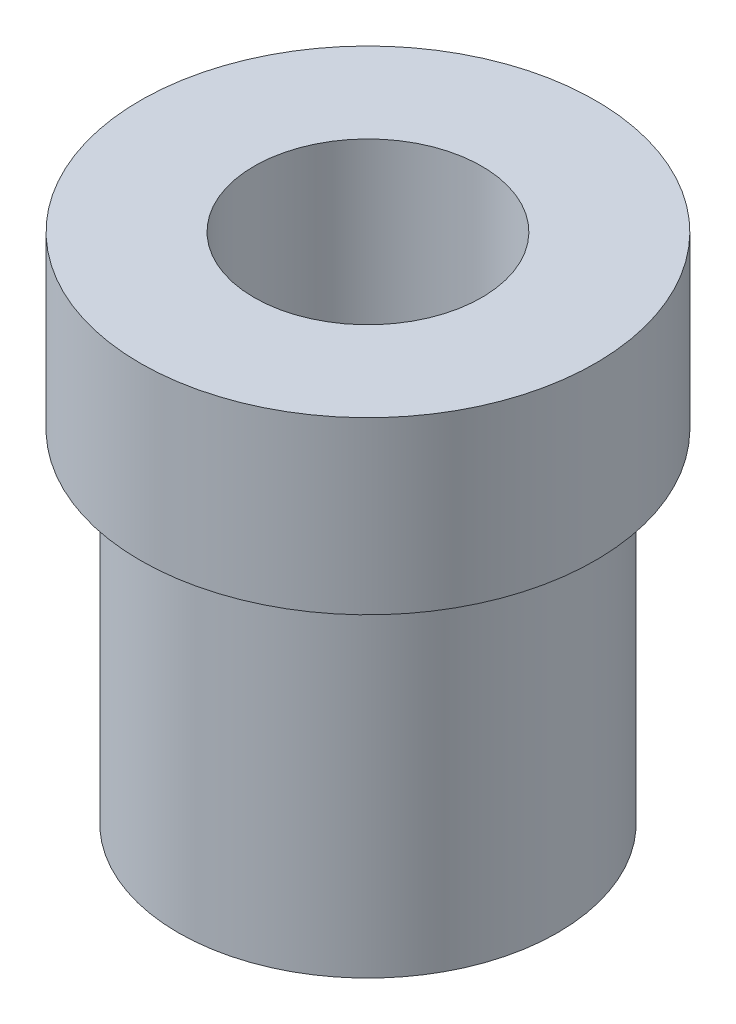
from build123d import *


with BuildPart() as part:
    # Sketch1 → Revolve1 (revolve)
    with BuildSketch(Plane.XY, mode=Mode.PRIVATE) as revolve1_sk:
        Polygon((3, 0), (3, -13.5), (5, -13.5), (5, -4.5), (6, -4.5), (6, 0), align=None)
    revolve(revolve1_sk.sketch.rotate(Axis((0, 12.429694721, 0), (0, -1, 0)), 90), axis=Axis((0, 12.429694721, 0), (0, -1, 0)))


solid = part.part
